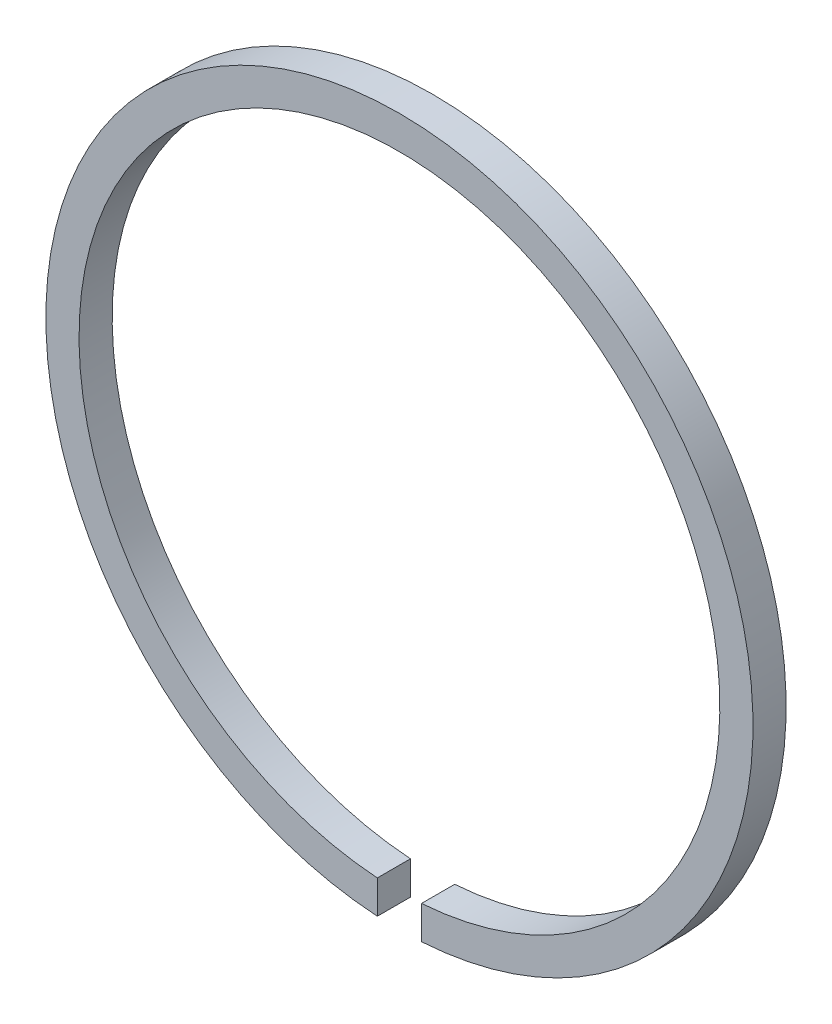
from build123d import *

# Parameters (mm, degrees)
BOSS_EXTRUDE1_DEPTH = 0.75


with BuildPart() as part:
    # Sketch1 → Boss-Extrude1 (new, symmetric)
    with BuildSketch(Plane.XY):
        with BuildLine():
            Line((-1, -14.465476141), (-1, -15.968719423))
            ThreePointArc((-1, -15.968719423), (0, 16), (1, -15.968719423))
            Line((1, -15.968719423), (1, -14.465476141))
            ThreePointArc((1, -14.465476141), (0, 14.5), (-1, -14.465476141))
        make_face()
    extrude(amount=BOSS_EXTRUDE1_DEPTH, both=True)


solid = part.part
